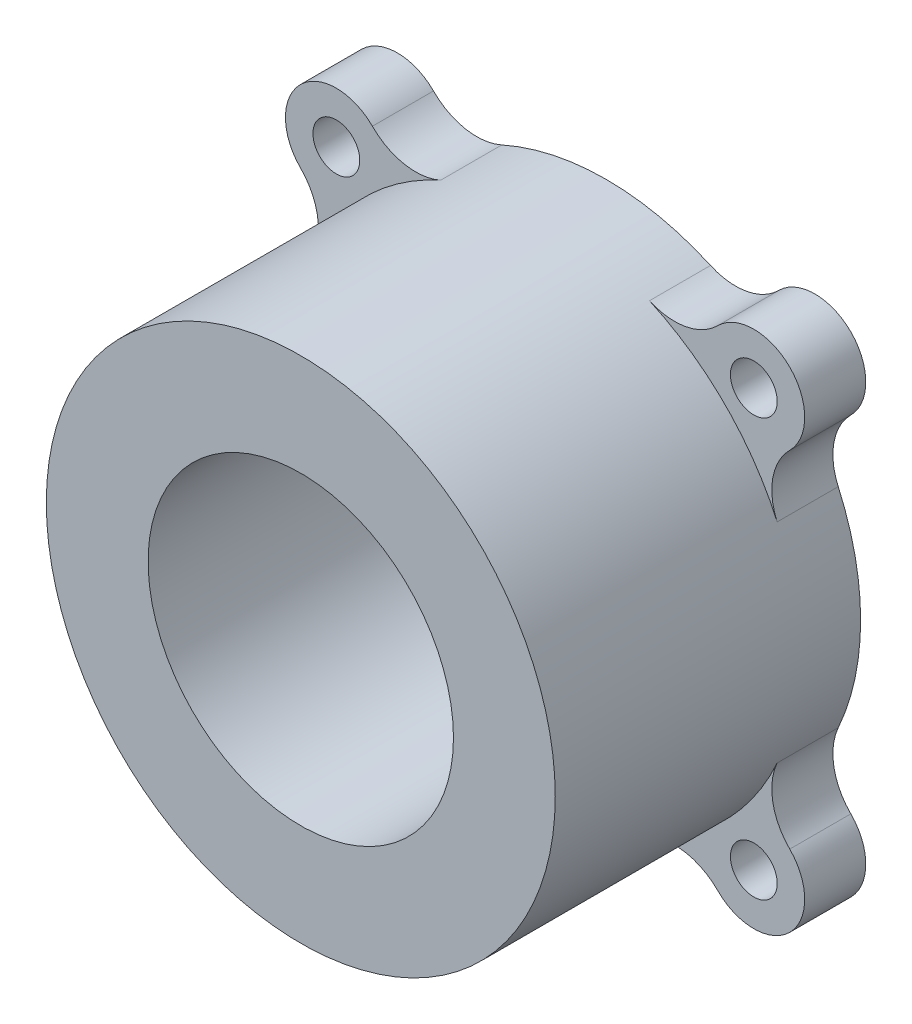
from build123d import *

# Parameters (mm, degrees)
SKETCH1_R           = 25
SKETCH1_R_2         = 15
BOSS_EXTRUDE1_DEPTH = 30
SKETCH2_R           = 5
SKETCH2_R_2         = 2.3
BOSS_EXTRUDE2_DEPTH = 6
FILLET1_R           = 6


with BuildPart() as part:
    # Sketch1 → Boss-Extrude1 (new body)
    with BuildSketch(Plane.XY):
        Circle(SKETCH1_R)
        Circle(SKETCH1_R_2, mode=Mode.SUBTRACT)
    extrude(amount=BOSS_EXTRUDE1_DEPTH)

    # Sketch2 → Boss-Extrude2 (add)
    # profile 1 of 4: a face of its own
    with BuildSketch(Plane(origin=(0, 0, 0), x_dir=(-1, 0, 0), z_dir=(0, 0, -1))):
        with Locations((20.506096654, 20.506096654)):
            Circle(SKETCH2_R)
        with Locations((20.506096654, 20.506096654)):
            Circle(SKETCH2_R_2, mode=Mode.SUBTRACT)
    # profile 2 of 4: a face of its own
    with BuildSketch(Plane(origin=(0, 0, 0), x_dir=(-1, 0, 0), z_dir=(0, 0, -1))):
        with Locations((20.506096654, -20.506096654)):
            Circle(SKETCH2_R)
        with Locations((20.506096654, -20.506096654)):
            Circle(SKETCH2_R_2, mode=Mode.SUBTRACT)
    # profile 3 of 4: a face of its own
    with BuildSketch(Plane(origin=(0, 0, 0), x_dir=(-1, 0, 0), z_dir=(0, 0, -1))):
        with Locations((-20.506096654, -20.506096654)):
            Circle(SKETCH2_R)
        with Locations((-20.506096654, -20.506096654)):
            Circle(SKETCH2_R_2, mode=Mode.SUBTRACT)
    # profile 4 of 4: a face of its own
    with BuildSketch(Plane(origin=(0, 0, 0), x_dir=(-1, 0, 0), z_dir=(0, 0, -1))):
        with Locations((-20.506096654, 20.506096654)):
            Circle(SKETCH2_R)
        with Locations((-20.506096654, 20.506096654)):
            Circle(SKETCH2_R_2, mode=Mode.SUBTRACT)
    extrude(amount=-BOSS_EXTRUDE2_DEPTH)

    # Fillet1
    fillet1_edges = [part.edges().sort_by_distance(p)[0] for p in [
        (-19.534483911, 15.601408216, 3),
        (-15.601408216, 19.534483911, 3),
        (-15.601408216, -19.534483911, 3),
        (-19.534483911, -15.601408216, 3),
        (19.534483911, -15.601408216, 3),
        (15.601408216, -19.534483911, 3),
        (15.601408216, 19.534483911, 3),
        (19.534483911, 15.601408216, 3),
    ]]
    fillet(fillet1_edges, radius=FILLET1_R)


solid = part.part
